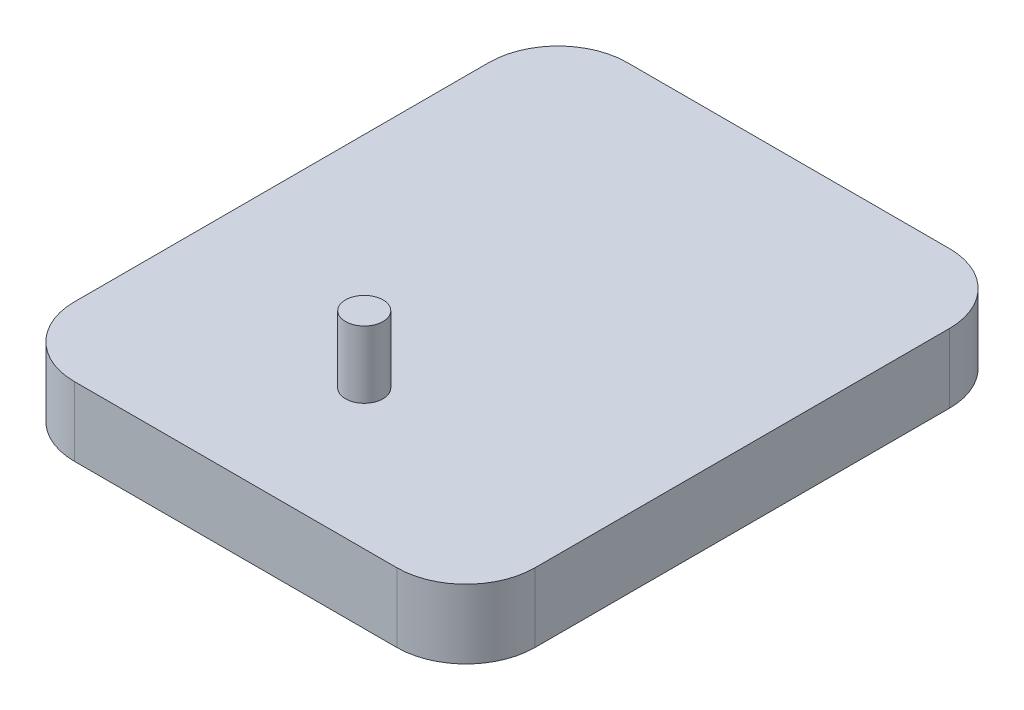
from build123d import *

# Parameters (mm, degrees)
SKETCH1_W           = 254
SKETCH1_H           = 304.8
BOSS_EXTRUDE1_DEPTH = 38.1
FILLET1_R           = 38.1
SKETCH4_W           = 10.353395652
SKETCH4_H           = 36.912106238


with BuildPart() as part:
    # Sketch1 → Boss-Extrude1 (new body)
    with BuildSketch(Plane(origin=(0, 0, 0), x_dir=(1, 0, 0), z_dir=(0, 1, 0))):
        Rectangle(SKETCH1_W, SKETCH1_H)
    extrude(amount=BOSS_EXTRUDE1_DEPTH)

    # Fillet1
    fillet1_edges = [part.edges().sort_by_distance(p)[0] for p in [
        (-127, 19.05, -152.4),
        (127, 19.05, -152.4),
        (127, 19.05, 152.4),
        (-127, 19.05, 152.4),
    ]]
    fillet(fillet1_edges, radius=FILLET1_R)


with BuildPart() as body_2:
    # Sketch4 → Revolve1 (revolve)
    with BuildSketch(Plane(origin=(0, 0, 0), x_dir=(0, 0, -1), z_dir=(1, 0, 0))):
        with Locations((-86.653420131, 62.489246975)):
            Rectangle(SKETCH4_W, SKETCH4_H)
    revolve(axis=Axis((0, 80.945300094, 81.476722305), (0, -1, 0)))


solid = Compound([part.part, body_2.part])
